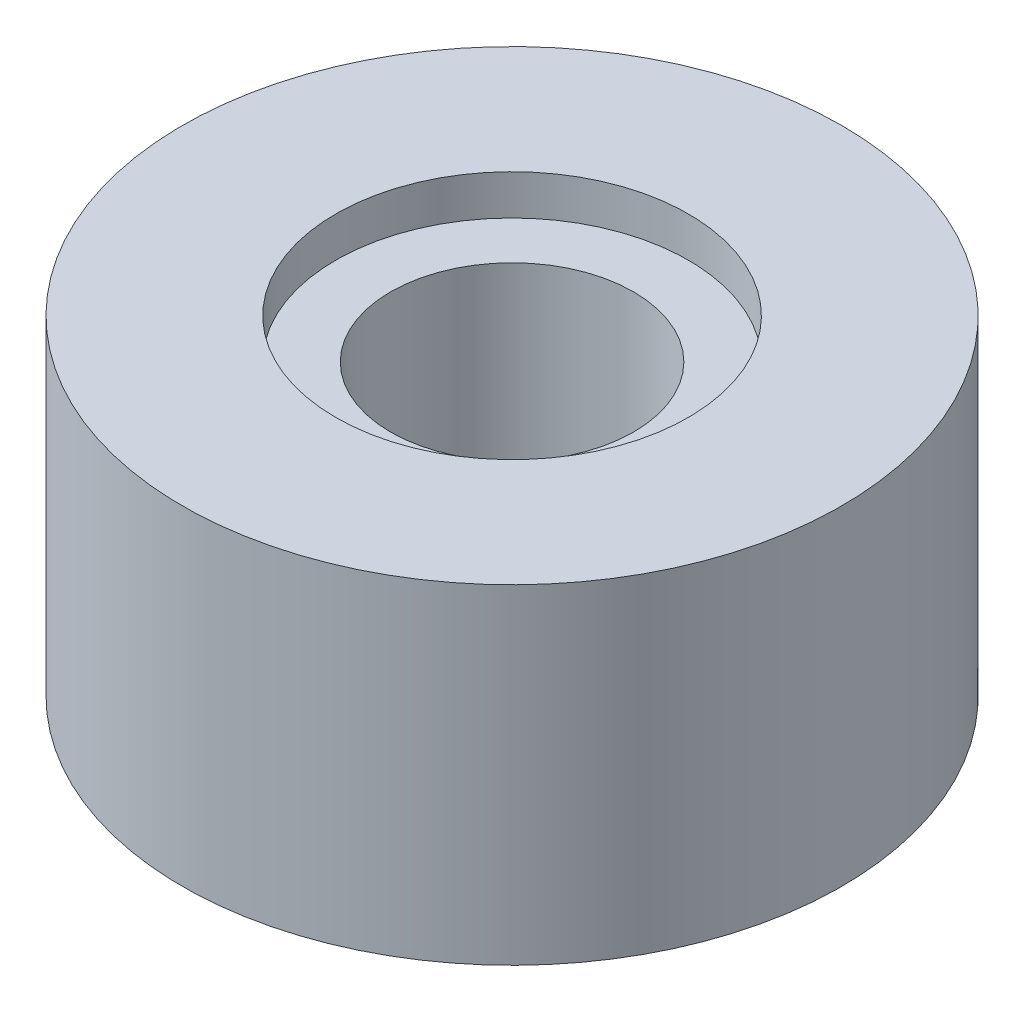
from build123d import *

# Parameters (mm, degrees)
SKETCH1_R           = 38.1
BOSS_EXTRUDE1_DEPTH = 38.1
SKETCH2_R           = 14.0462
CUT_EXTRUDE1_DEPTH  = 76.2
SKETCH3_R           = 20.3835
CUT_EXTRUDE2_DEPTH  = 4.63296
SKETCH4_R           = 30.0355
CUT_EXTRUDE3_DEPTH  = 12.7


with BuildPart() as part:
    # Sketch1 → Boss-Extrude1 (new body)
    with BuildSketch(Plane(origin=(0, 0, 0), x_dir=(1, 0, 0), z_dir=(0, 1, 0))):
        with Locations(Location((0, 0, 0), (0, 0, 90))):
            Circle(SKETCH1_R)
    extrude(amount=BOSS_EXTRUDE1_DEPTH)

    # Sketch2 → Cut-Extrude1 (cut)
    with BuildSketch(Plane.XZ):
        with Locations(Location((0, 0, 0), (0, 0, 270))):
            Circle(SKETCH2_R)
    extrude(amount=-CUT_EXTRUDE1_DEPTH, mode=Mode.SUBTRACT)

    # Sketch3 → Cut-Extrude2 (cut)
    with BuildSketch(Plane(origin=(0, 38.1, 0), x_dir=(1, 0, 0), z_dir=(0, 1, 0))):
        with Locations(Location((0, 0, 0), (0, 0, 270))):
            Circle(SKETCH3_R)
    extrude(amount=-CUT_EXTRUDE2_DEPTH, mode=Mode.SUBTRACT)

    # Sketch4 → Cut-Extrude3 (cut)
    with BuildSketch(Plane.XZ):
        with Locations(Location((0, 0, 0), (0, 0, 270))):
            Circle(SKETCH4_R)
    extrude(amount=-CUT_EXTRUDE3_DEPTH, mode=Mode.SUBTRACT)


solid = part.part
